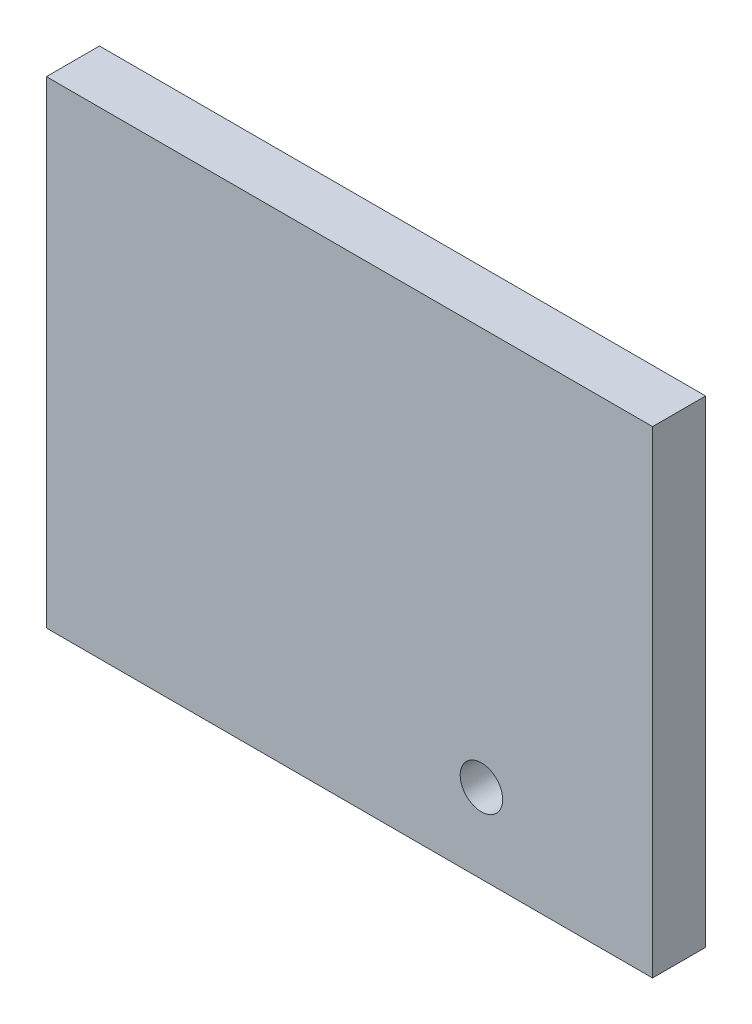
from build123d import *

# Parameters (mm, degrees)
SKETCH1_W           = 114.24
SKETCH1_H           = 10
BOSS_EXTRUDE1_DEPTH = 10
SKETCH3_W           = 114.24
SKETCH3_H           = 10
BOSS_EXTRUDE2_DEPTH = 80
SKETCH4_R           = 4
CUT_EXTRUDE1_DEPTH  = 103.896522779


with BuildPart() as part:
    # Sketch1 → Boss-Extrude1 (new body)
    with BuildSketch(Plane.XY):
        Rectangle(SKETCH1_W, SKETCH1_H)
    extrude(amount=BOSS_EXTRUDE1_DEPTH)

    # Sketch3 → Boss-Extrude2 (add)
    with BuildSketch(Plane(origin=(0, 5, 0), x_dir=(1, 0, 0), z_dir=(0, 1, 0))):
        with Locations((0, -5)):
            Rectangle(SKETCH3_W, SKETCH3_H)
    extrude(amount=BOSS_EXTRUDE2_DEPTH)

    # Sketch4 → Cut-Extrude1 (cut, through all)
    with BuildSketch(Plane.XY.offset(10)):
        with Locations((24.87, 9.99)):
            Circle(SKETCH4_R)
    extrude(amount=-CUT_EXTRUDE1_DEPTH, mode=Mode.SUBTRACT)


solid = part.part
